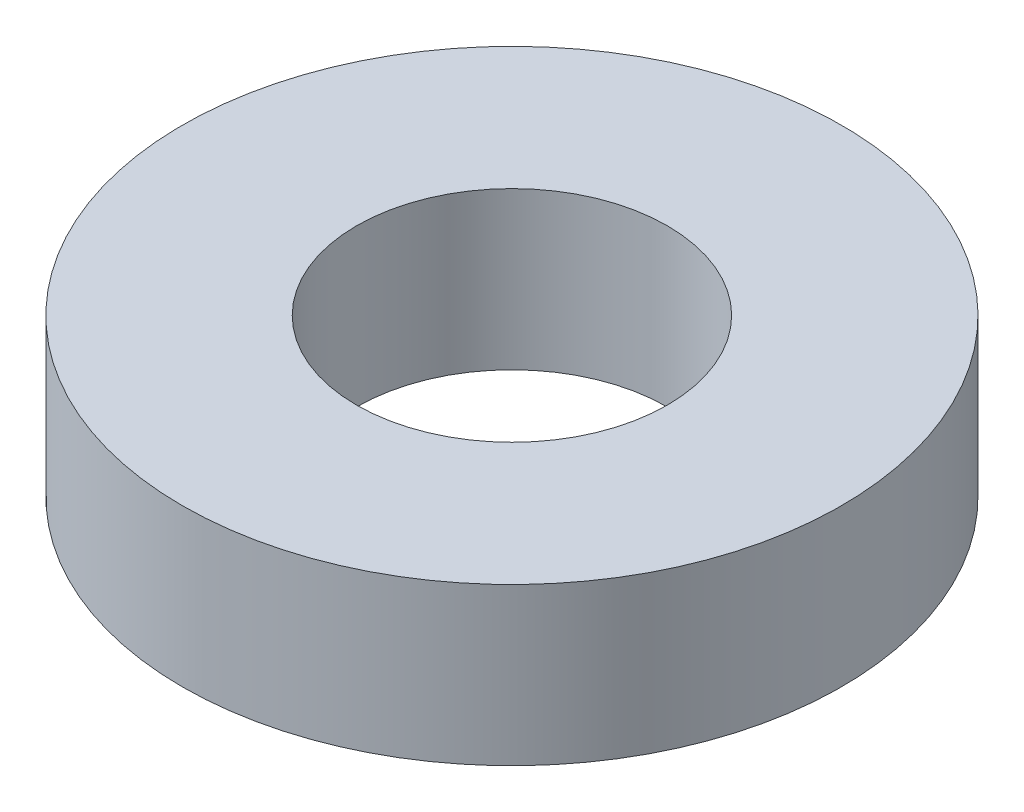
from build123d import *

# Parameters (mm, degrees)
SKETCH1_R           = 10.5
SKETCH1_R_2         = 4.95
BOSS_EXTRUDE1_DEPTH = 5


with BuildPart() as part:
    # Sketch1 → Boss-Extrude1 (new body)
    with BuildSketch(Plane(origin=(0, 0, 0), x_dir=(1, 0, 0), z_dir=(0, 1, 0))):
        with Locations(Location((0, 0, 0), (0, 0, 270))):
            Circle(SKETCH1_R)
        with Locations(Location((0, 0, 0), (0, 0, 270))):
            Circle(SKETCH1_R_2, mode=Mode.SUBTRACT)
    extrude(amount=BOSS_EXTRUDE1_DEPTH)


solid = part.part
